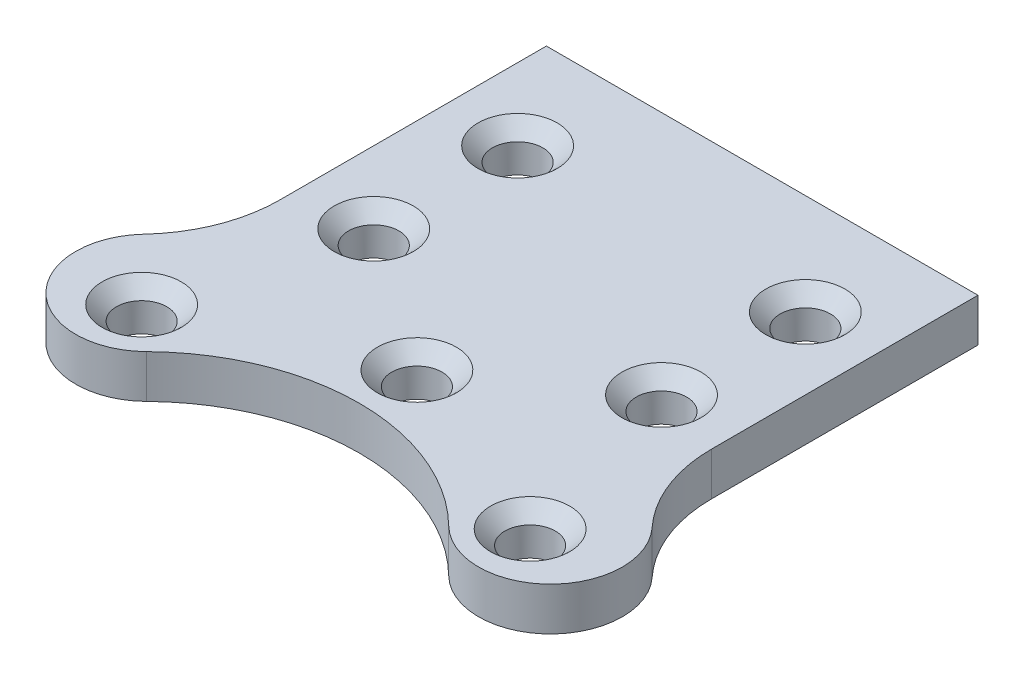
from build123d import *

# Parameters (mm, degrees)
BOSS_EXTRUDE1_DEPTH = 3
FILLET1_R           = 10
SKETCH2_R           = 1.75
CUT_EXTRUDE1_DEPTH  = 34.970575503
CHAMFER1_SIZE       = 1


with BuildPart() as part:
    # Sketch1 → Boss-Extrude1 (new body)
    with BuildSketch(Plane(origin=(0, 0, 0), x_dir=(1, 0, 0), z_dir=(0, 1, 0))):
        with BuildLine():
            Line((-15, 4.181836343), (-15, 28))
            Line((-15, 28), (15, 28))
            Line((15, 28), (15, 4.181836343))
            ThreePointArc((15, 4.181836343), (18.415475947, -3.063112486), (10.5, -4.287857357))
            ThreePointArc((10.5, -4.287857357), (0, 0), (-10.5, -4.287857357))
            ThreePointArc((-10.5, -4.287857357), (-18.415475947, -3.063112486), (-15, 4.181836343))
        make_face()
    extrude(amount=BOSS_EXTRUDE1_DEPTH)

    # Fillet1
    fillet1_edges = [part.edges().sort_by_distance(p)[0] for p in [
        (-15, 1.5, -4.181836343),
        (15, 1.5, -4.181836343),
    ]]
    fillet(fillet1_edges, radius=FILLET1_R)

    # Sketch2 → Cut-Extrude1 (cut, through all)
    with BuildSketch(Plane(origin=(0, 3, 0), x_dir=(1, 0, 0), z_dir=(0, 1, 0))):
        with Locations(Location((0, 4, 0), (0, 0, 270))):
            Circle(SKETCH2_R)
        with Locations(Location((13.5, -1.630258043, 0), (0, 0, 270))):
            Circle(SKETCH2_R)
        with Locations(Location((-13.5, -1.630258043, 0), (0, 0, 270))):
            Circle(SKETCH2_R)
        with Locations(Location((-10, 11, 0), (0, 0, 270))):
            Circle(SKETCH2_R)
        with Locations(Location((-10, 21, 0), (0, 0, 270))):
            Circle(SKETCH2_R)
        with Locations(Location((10, 21, 0), (0, 0, 270))):
            Circle(SKETCH2_R)
        with Locations(Location((10, 11, 0), (0, 0, 270))):
            Circle(SKETCH2_R)
    extrude(amount=-CUT_EXTRUDE1_DEPTH, mode=Mode.SUBTRACT)

    # Chamfer1
    chamfer1_edges = [part.edges().sort_by_distance(p)[0] for p in [
        (0, 3, -5.75),
        (13.5, 3, -0.119741957),
        (-13.5, 3, -0.119741957),
        (-10, 3, -12.75),
        (-10, 3, -22.75),
        (10, 3, -22.75),
        (10, 3, -12.75),
    ]]
    chamfer(chamfer1_edges, length=CHAMFER1_SIZE)


solid = part.part
